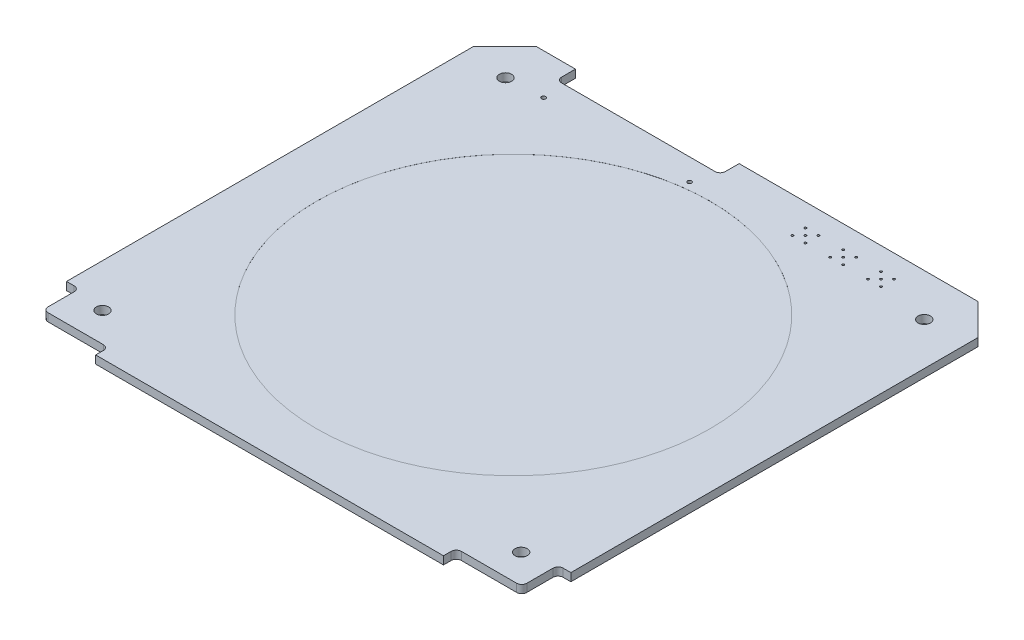
from build123d import *

# Parameters (mm, degrees)
SKETCH1_R                = 0.4
SKETCH1_R_2              = 0.2125
BOSS_EXTRUDE1_DEPTH      = 1.56
SKETCH2_R                = 38.5
CUT_EXTRUDE1_DEPTH       = 0.01
M2_CLEARANCE_HOLE2_D     = 2.4
M2_CLEARANCE_HOLE2_DEPTH = 38.1
M2_CLEARANCE_HOLE2_TIP   = 0.721032743


with BuildPart() as part:
    # Sketch1 → Boss-Extrude1 (new body)
    with BuildSketch(Plane(origin=(0, 0, 0), x_dir=(1, 0, 0), z_dir=(0, 1, 0))):
        with BuildLine():
            Line((-49.356685196, 41.604788024), (-43.256685196, 47.704788024))
            Line((-43.256685196, 47.704788024), (-35.556685196, 47.704788024))
            Line((-35.556685196, 47.704788024), (-35.556685196, 45.004788024))
            ThreePointArc((-35.556685196, 45.004788024), (-35.263791977, 44.297681243), (-34.556685196, 44.004788024))
            Line((-34.556685196, 44.004788024), (-4.556685196, 44.004788024))
            ThreePointArc((-4.556685196, 44.004788024), (-3.849578415, 44.297681243), (-3.556685196, 45.004788024))
            Line((-3.556685196, 45.004788024), (-3.556685196, 47.704788024))
            Line((-3.556685196, 47.704788024), (43.143314804, 47.704788024))
            Line((43.143314804, 47.704788024), (49.243314804, 41.604788024))
            Line((49.243314804, 41.604788024), (49.243314804, -37.995211976))
            Line((49.243314804, -37.995211976), (47.743314804, -37.995211976))
            ThreePointArc((47.743314804, -37.995211976), (47.036208023, -38.288105194), (46.743314804, -38.995211976))
            Line((46.743314804, -38.995211976), (46.743314804, -44.095211976))
            ThreePointArc((46.743314804, -44.095211976), (46.450421585, -44.802318757), (45.743314804, -45.095211976))
            Line((45.743314804, -45.095211976), (34.943314804, -45.095211976))
            ThreePointArc((34.943314804, -45.095211976), (34.236208023, -45.388105194), (33.943314804, -46.095211976))
            Line((33.943314804, -46.095211976), (33.943314804, -47.595211976))
            Line((33.943314804, -47.595211976), (-34.056685196, -47.595211976))
            Line((-34.056685196, -47.595211976), (-34.056685196, -46.095211976))
            ThreePointArc((-34.056685196, -46.095211976), (-34.349578415, -45.388105194), (-35.056685196, -45.095211976))
            Line((-35.056685196, -45.095211976), (-45.856685196, -45.095211976))
            ThreePointArc((-45.856685196, -45.095211976), (-46.563791977, -44.802318757), (-46.856685196, -44.095211976))
            Line((-46.856685196, -44.095211976), (-46.856685196, -38.995211976))
            ThreePointArc((-46.856685196, -38.995211976), (-47.149578415, -38.288105194), (-47.856685196, -37.995211976))
            Line((-47.856685196, -37.995211976), (-49.356685196, -37.995211976))
            Line((-49.356685196, -37.995211976), (-49.356685196, 41.604788024))
        make_face()
        with Locations(Location((-33.826685196, 39.744788024, 0), (0, 0, 270))):
            Circle(SKETCH1_R, mode=Mode.SUBTRACT)
        with Locations(Location((-5.276685196, 39.744788024, 0), (0, 0, 270))):
            Circle(SKETCH1_R, mode=Mode.SUBTRACT)
        with Locations(Location((29.883314804, 42.004788024, 0), (0, 0, 270))):
            Circle(SKETCH1_R_2, mode=Mode.SUBTRACT)
        with Locations(Location((28.613314804, 43.274788024, 0), (0, 0, 270))):
            Circle(SKETCH1_R_2, mode=Mode.SUBTRACT)
        with Locations(Location((31.153314804, 43.274788024, 0), (0, 0, 270))):
            Circle(SKETCH1_R_2, mode=Mode.SUBTRACT)
        with Locations(Location((31.153314804, 40.734788024, 0), (0, 0, 270))):
            Circle(SKETCH1_R_2, mode=Mode.SUBTRACT)
        with Locations(Location((28.613314804, 40.734788024, 0), (0, 0, 270))):
            Circle(SKETCH1_R_2, mode=Mode.SUBTRACT)
        with Locations(Location((22.483314804, 42.004788024, 0), (0, 0, 270))):
            Circle(SKETCH1_R_2, mode=Mode.SUBTRACT)
        with Locations(Location((21.213314804, 43.274788024, 0), (0, 0, 270))):
            Circle(SKETCH1_R_2, mode=Mode.SUBTRACT)
        with Locations(Location((23.753314804, 43.274788024, 0), (0, 0, 270))):
            Circle(SKETCH1_R_2, mode=Mode.SUBTRACT)
        with Locations(Location((23.753314804, 40.734788024, 0), (0, 0, 270))):
            Circle(SKETCH1_R_2, mode=Mode.SUBTRACT)
        with Locations(Location((21.213314804, 40.734788024, 0), (0, 0, 270))):
            Circle(SKETCH1_R_2, mode=Mode.SUBTRACT)
        with Locations(Location((15.083314804, 42.004788024, 0), (0, 0, 270))):
            Circle(SKETCH1_R_2, mode=Mode.SUBTRACT)
        with Locations(Location((13.813314804, 43.274788024, 0), (0, 0, 270))):
            Circle(SKETCH1_R_2, mode=Mode.SUBTRACT)
        with Locations(Location((16.353314804, 43.274788024, 0), (0, 0, 270))):
            Circle(SKETCH1_R_2, mode=Mode.SUBTRACT)
        with Locations(Location((16.353314804, 40.734788024, 0), (0, 0, 270))):
            Circle(SKETCH1_R_2, mode=Mode.SUBTRACT)
        with Locations(Location((13.813314804, 40.734788024, 0), (0, 0, 270))):
            Circle(SKETCH1_R_2, mode=Mode.SUBTRACT)
    extrude(amount=BOSS_EXTRUDE1_DEPTH)

    # Sketch2 → Cut-Extrude1 (cut)
    with BuildSketch(Plane(origin=(0, 1.56, 0), x_dir=(1, 0, 0), z_dir=(0, 1, 0))):
        with Locations(Location((0, 0, 0), (0, 0, 270))):
            Circle(SKETCH2_R)
    extrude(amount=-CUT_EXTRUDE1_DEPTH, mode=Mode.SUBTRACT)

    # M2 Clearance Hole2
    with Locations(Plane(origin=(0, 1.56, 0), x_dir=(1, 0, 0), z_dir=(0, 1, 0))):
        with Locations((-40.929491149, 39.39737116), (40.929491149, 39.39737116), (40.929491149, -39.39737116), (-40.929491149, -39.39737116)):
            Hole(M2_CLEARANCE_HOLE2_D / 2, depth=M2_CLEARANCE_HOLE2_DEPTH)
            with Locations((0, 0, -(M2_CLEARANCE_HOLE2_DEPTH + M2_CLEARANCE_HOLE2_TIP / 2))):  # 118° drill point
                Cone(0, M2_CLEARANCE_HOLE2_D / 2, M2_CLEARANCE_HOLE2_TIP, mode=Mode.SUBTRACT)


solid = part.part
